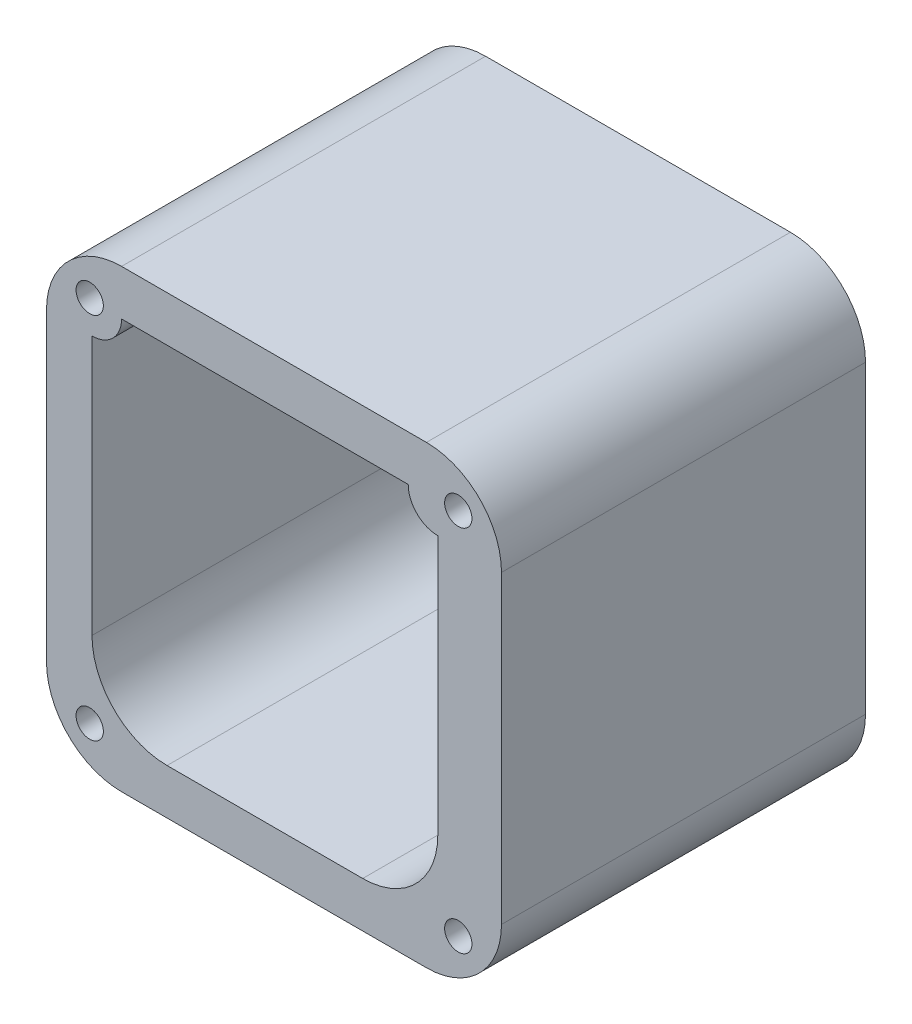
from build123d import *

# Parameters (mm, degrees)
BOSS_EXTRUDE1_DEPTH = 20.32
CUT_EXTRUDE1_START  = -17.78
CUT_EXTRUDE1_DEPTH  = 17.78
SKETCH3_6_R         = 0.762
CUT_EXTRUDE2_DEPTH  = 13.97
SKETCH3_7_R         = 0.762
CUT_EXTRUDE3_DEPTH  = 13.97
SKETCH3_8_R         = 0.762
CUT_EXTRUDE4_DEPTH  = 13.97
SKETCH3_9_R         = 0.762
CUT_EXTRUDE5_DEPTH  = 13.97


with BuildPart() as part:
    # Sketch1 → Boss-Extrude1 (new body)
    with BuildSketch(Plane.XY):
        with BuildLine():
            ThreePointArc((9.017, -9.017), (11.32406957, -8.324844238), (12.869100726, -6.477))
            ThreePointArc((12.869100726, -6.477), (13.122401024, -5.668711949), (13.208, -4.826))
            Line((13.208, -4.826), (13.208, 12.192))
            ThreePointArc((13.208, 12.192), (11.98048452, 15.15548452), (9.017, 16.383))
            Line((9.017, 16.383), (-8.001, 16.383))
            ThreePointArc((-8.001, 16.383), (-10.96448452, 15.15548452), (-12.192, 12.192))
            Line((-12.192, 12.192), (-12.192, -4.826))
            ThreePointArc((-12.192, -4.826), (-10.96448452, -7.78948452), (-8.001, -9.017))
            Line((-8.001, -9.017), (9.017, -9.017))
        make_face()
        with BuildLine():
            Line((5.461, -6.477), (-5.461, -6.477))
            ThreePointArc((-5.461, -6.477), (-8.42448452, -5.24948452), (-9.652, -2.286))
            Line((-9.652, -2.286), (-9.652, 2.286))
            ThreePointArc((-9.652, 2.286), (-8.42448452, 5.24948452), (-5.461, 6.477))
            Line((-5.461, 6.477), (5.461, 6.477))
            ThreePointArc((5.461, 6.477), (8.42448452, 5.24948452), (9.652, 2.286))
            Line((9.652, 2.286), (9.652, -2.286))
            ThreePointArc((9.652, -2.286), (8.42448452, -5.24948452), (5.461, -6.477))
        make_face(mode=Mode.SUBTRACT)
    extrude(amount=BOSS_EXTRUDE1_DEPTH)

    # Sketch3 → Cut-Extrude1 (cut)
    with BuildSketch(Plane.XY.offset(20.32).offset(CUT_EXTRUDE1_START)):
        with BuildLine():
            Line((-9.652, 12.192), (-9.652, 2.286))
            ThreePointArc((-9.652, 2.286), (-8.42448452, 5.24948452), (-5.461, 6.477))
            Line((-5.461, 6.477), (5.461, 6.477))
            ThreePointArc((5.461, 6.477), (8.42448452, 5.24948452), (9.652, 2.286))
            Line((9.652, 2.286), (9.652, 3.683))
            Line((9.652, 3.683), (9.652, 12.192))
            ThreePointArc((9.652, 12.192), (8.484566704, 12.675566704), (8.001, 13.843))
            Line((8.001, 13.843), (-8.001, 13.843))
            ThreePointArc((-8.001, 13.843), (-8.484566704, 12.675566704), (-9.652, 12.192))
        make_face()
    extrude(amount=CUT_EXTRUDE1_DEPTH, mode=Mode.SUBTRACT)

    # Sketch3<6> → Cut-Extrude2 (cut)
    with BuildSketch(Plane.XY.offset(20.32)):
        with Locations((-9.779, 13.97)):
            Circle(SKETCH3_6_R)
    extrude(amount=-CUT_EXTRUDE2_DEPTH, mode=Mode.SUBTRACT)

    # Sketch3<7> → Cut-Extrude3 (cut)
    with BuildSketch(Plane.XY.offset(20.32)):
        with Locations((10.795, 13.97)):
            Circle(SKETCH3_7_R)
    extrude(amount=-CUT_EXTRUDE3_DEPTH, mode=Mode.SUBTRACT)

    # Sketch3<8> → Cut-Extrude4 (cut)
    with BuildSketch(Plane.XY.offset(20.32)):
        with Locations((10.795, -6.604)):
            Circle(SKETCH3_8_R)
    extrude(amount=-CUT_EXTRUDE4_DEPTH, mode=Mode.SUBTRACT)

    # Sketch3<9> → Cut-Extrude5 (cut)
    with BuildSketch(Plane.XY.offset(20.32)):
        with Locations((-9.779, -6.604)):
            Circle(SKETCH3_9_R)
    extrude(amount=-CUT_EXTRUDE5_DEPTH, mode=Mode.SUBTRACT)


solid = part.part
